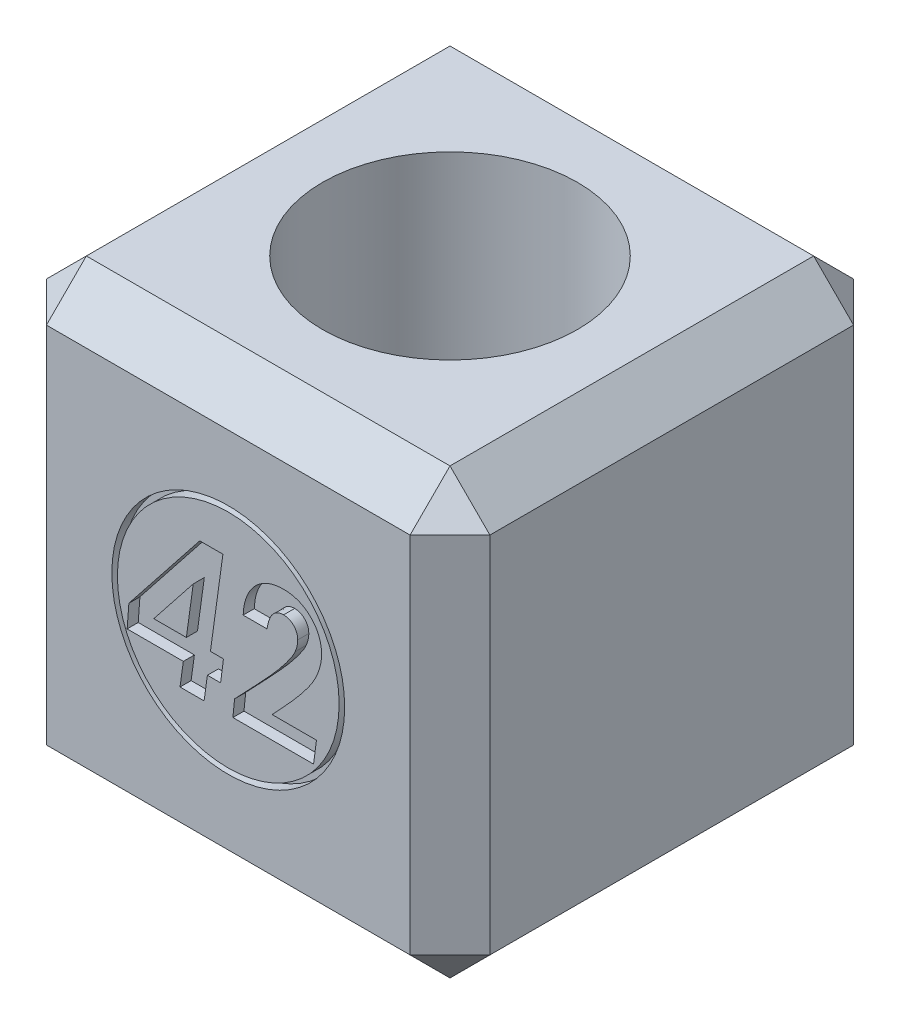
from build123d import *

# Parameters (mm, degrees)
SKETCH_1_W          = 200
SKETCH_1_H          = 200
EXTRUDE_1_DEPTH     = 200
CHAMFER_1_SIZE      = 18
SKETCH_2_R          = 57.5
CUT_EXTRUDE_1_DEPTH = 150
SKETCH_3_R          = 52.5
SKETCH_3_R_2        = 50
CUT_EXTRUDE_4_DEPTH = 5


with BuildPart() as part:
    # 草图1 → 凸台-拉伸1 (new body)
    with BuildSketch(Plane(origin=(0, 0, 0), x_dir=(0, 0, -1), z_dir=(1, 0, 0))):
        with Locations((100, 100)):
            Rectangle(SKETCH_1_W, SKETCH_1_H)
    extrude(amount=EXTRUDE_1_DEPTH)

    # 倒角1
    chamfer_1_edges = [part.edges().sort_by_distance(p)[0] for p in [
        (0, 100, -200),
        (100, 0, -200),
        (0, 0, -100),
        (200, 100, -200),
        (200, 0, -100),
        (200, 100, 0),
        (100, 0, 0),
        (0, 100, 0),
        (100, 200, -200),
        (200, 200, -100),
        (100, 200, 0),
        (0, 200, -100),
    ]]
    chamfer(chamfer_1_edges, length=CHAMFER_1_SIZE)

    # 草图2 → 切除-拉伸1 (cut)
    with BuildSketch(Plane(origin=(0, 200, 0), x_dir=(1, 0, 0), z_dir=(0, 1, 0))):
        with Locations((100, 100)):
            Circle(SKETCH_2_R)
    extrude(amount=-CUT_EXTRUDE_1_DEPTH, mode=Mode.SUBTRACT)

    # 草图3 → 切除-拉伸4 (cut)
    # profile 1 of 3: a face of its own
    with BuildSketch(Plane.XY):
        with Locations((100, 100)):
            Circle(SKETCH_3_R)
        with Locations((100, 100)):
            Circle(SKETCH_3_R_2, mode=Mode.SUBTRACT)
    # profile 2 of 3: a face of its own
    with BuildSketch(Plane.XY):
        with BuildLine():
            Line((106.707617876, 113.080985442), (117.476848645, 113.080985442))
            add(Edge.make_bspline(
                [(124.952810184, 122.311754672), (124.061928668, 122.316141415), (122.723328375, 122.065314477), (121.15976707, 121.17726781), (120.31812048, 120.404799304), (119.711791362, 119.661639483), (119.299662129, 118.992437635), (118.890623993, 118.246055909), (118.558018296, 117.387310251), (118.225423141, 116.448647339), (117.836741696, 115.008969129), (117.587459376, 113.876131637), (117.476848645, 113.080985442)],
                knots=[0, 0, 0, 0, 0.204127863, 0.304431221, 0.408409421, 0.463887314, 0.523727039, 0.588196002, 0.658593566, 0.734357814, 0.816313439, 1, 1, 1, 1], degree=3))
            add(Edge.make_bspline(
                [(131.323002492, 115.701177749), (131.302782595, 116.579231828), (131.136297941, 117.914660904), (130.3064802, 119.455009614), (129.500708922, 120.45075585), (128.538845138, 121.277303266), (127.061812678, 122.101056155), (125.792809521, 122.304509149), (124.952810184, 122.311754672)],
                knots=[0, 0, 0, 0, 0.259693846, 0.38313667, 0.508398189, 0.633351073, 0.752658268, 1, 1, 1, 1], degree=3))
            add(Edge.make_bspline(
                [(130.157137107, 110.508870057), (130.511822539, 111.366072382), (131.120426847, 113.057426489), (131.319730922, 114.845166367), (131.323002492, 115.701177749)],
                knots=[0, 0, 0, 0, 0.520562004, 1, 1, 1, 1], degree=3))
            add(Edge.make_bspline(
                [(122.609060184, 99.727620057), (123.542457488, 100.855288981), (124.884611957, 102.474543208), (126.494767665, 104.618871476), (127.522861077, 106.015472175), (128.390657407, 107.310563545), (129.306154563, 108.764488546), (129.869005007, 109.828049592), (130.157137107, 110.508870057)],
                knots=[0, 0, 0, 0, 0.332831745, 0.477817127, 0.609520417, 0.726973213, 0.832099586, 1, 1, 1, 1], degree=3))
            add(Edge.make_bspline(
                [(102.86146403, 78.465600826), (104.073053727, 79.737856076), (105.861414534, 81.588001167), (108.15811719, 84.030126363), (109.77444844, 85.719605027), (111.292181295, 87.342421418), (112.742192845, 88.873377879), (114.109044196, 90.319346392), (115.381760254, 91.694514713), (116.578546994, 92.97827206), (117.673765861, 94.197556125), (118.717301158, 95.306997342), (119.650706014, 96.356133448), (120.503599196, 97.32161107), (121.495876039, 98.422484298), (122.172586535, 99.230130727), (122.609060184, 99.727620057)],
                knots=[0, 0, 0, 0, 0.181614482, 0.265988361, 0.346548719, 0.423311675, 0.495675135, 0.564525855, 0.628995855, 0.68936882, 0.745950656, 0.798411213, 0.846803604, 0.891102717, 0.931584129, 1, 1, 1, 1], degree=3))
            Line((102.86146403, 78.465600826), (102.092233261, 70.773293134))
            Line((102.092233261, 70.773293134), (138.462425568, 70.773293134))
            Line((138.462425568, 70.773293134), (139.784540953, 80.773293134))
            Line((139.784540953, 80.773293134), (119.784540953, 80.773293134))
            add(Edge.make_bspline(
                [(142.092233261, 115.376658519), (142.09732202, 114.393518355), (141.95430932, 112.905639606), (141.581070463, 110.915109319), (141.148217608, 109.37826343), (140.624528159, 107.801834253), (139.967531924, 106.199142481), (139.199146108, 104.565449003), (138.455218348, 103.183260504), (137.779650529, 102.028028639), (137.171822841, 101.090201616), (136.490804976, 100.08130842), (135.711268931, 99.01064295), (134.866860384, 97.854812526), (133.910144174, 96.645058775), (132.880240035, 95.363192003), (131.771215601, 94.008863585), (130.567357552, 92.595436285), (129.285008389, 91.105753441), (127.911135514, 89.550736384), (126.443361597, 87.93660771), (124.906447454, 86.233134327), (122.679244122, 83.836732523), (120.967131822, 82.003308094), (119.784540953, 80.773293134)],
                knots=[0, 0, 0, 0, 0.069981715, 0.106336674, 0.144238498, 0.183709243, 0.224708791, 0.267639701, 0.312364973, 0.33656381, 0.36302672, 0.392021296, 0.423331852, 0.457435971, 0.494060334, 0.533269791, 0.574668339, 0.618846706, 0.665626965, 0.714798059, 0.766769623, 0.82116182, 0.878361292, 1, 1, 1, 1], degree=3))
            add(Edge.make_bspline(
                [(124.988867876, 132.311754672), (126.175754308, 132.315676764), (127.93496111, 132.179510664), (130.186678669, 131.655134145), (131.7726869, 131.129273666), (133.268472003, 130.437845008), (134.687294958, 129.602483287), (136.026293603, 128.613446176), (137.265267034, 127.476325352), (138.390653811, 126.231694174), (139.384787852, 124.902245602), (140.228434325, 123.499377361), (140.906924261, 122.013604885), (141.434573231, 120.458552141), (141.959304994, 118.255123496), (142.09551179, 116.535641705), (142.092233261, 115.376658519)],
                knots=[0, 0, 0, 0, 0.132319326, 0.195567087, 0.25726574, 0.318197153, 0.378841636, 0.440456231, 0.50334526, 0.56593404, 0.627190101, 0.688062599, 0.747996218, 0.808849065, 0.870792773, 1, 1, 1, 1], degree=3))
            add(Edge.make_bspline(
                [(106.707617876, 113.080985442), (106.781895264, 114.937649447), (107.131475338, 117.664732571), (108.237782966, 121.070374863), (109.302543269, 123.370468484), (110.613437766, 125.442055382), (112.132515124, 127.267990733), (113.875631172, 128.806059043), (115.795871388, 130.092952145), (117.895783577, 131.088301864), (120.9374414, 132.05768373), (123.358242769, 132.306151558), (124.988867876, 132.311754672)],
                knots=[0, 0, 0, 0, 0.188116369, 0.27589316, 0.361277617, 0.44378986, 0.523169186, 0.600666658, 0.678099482, 0.756216315, 0.834899655, 1, 1, 1, 1], degree=3))
        make_face()
    # profile 3 of 3: a face of its own
    with BuildSketch(Plane.XY):
        Polygon((97.585021722, 132.311754672), (87.140310184, 132.311754672), (55.169156338, 91.951177749), (54.399925568, 81.542523903), (79.73646403, 81.542523903), (78.246079415, 70.773293134), (89.099444799, 70.773293134), (90.589829415, 81.542523903), (96.539348645, 81.542523903), (97.837425568, 91.542523903), (91.960021722, 91.542523903), align=None)
        Polygon((66.407137107, 91.542523903), (84.207617876, 114.018485442), (81.106656338, 91.542523903), align=None, mode=Mode.SUBTRACT)
    extrude(amount=-CUT_EXTRUDE_4_DEPTH, mode=Mode.SUBTRACT)


solid = part.part
